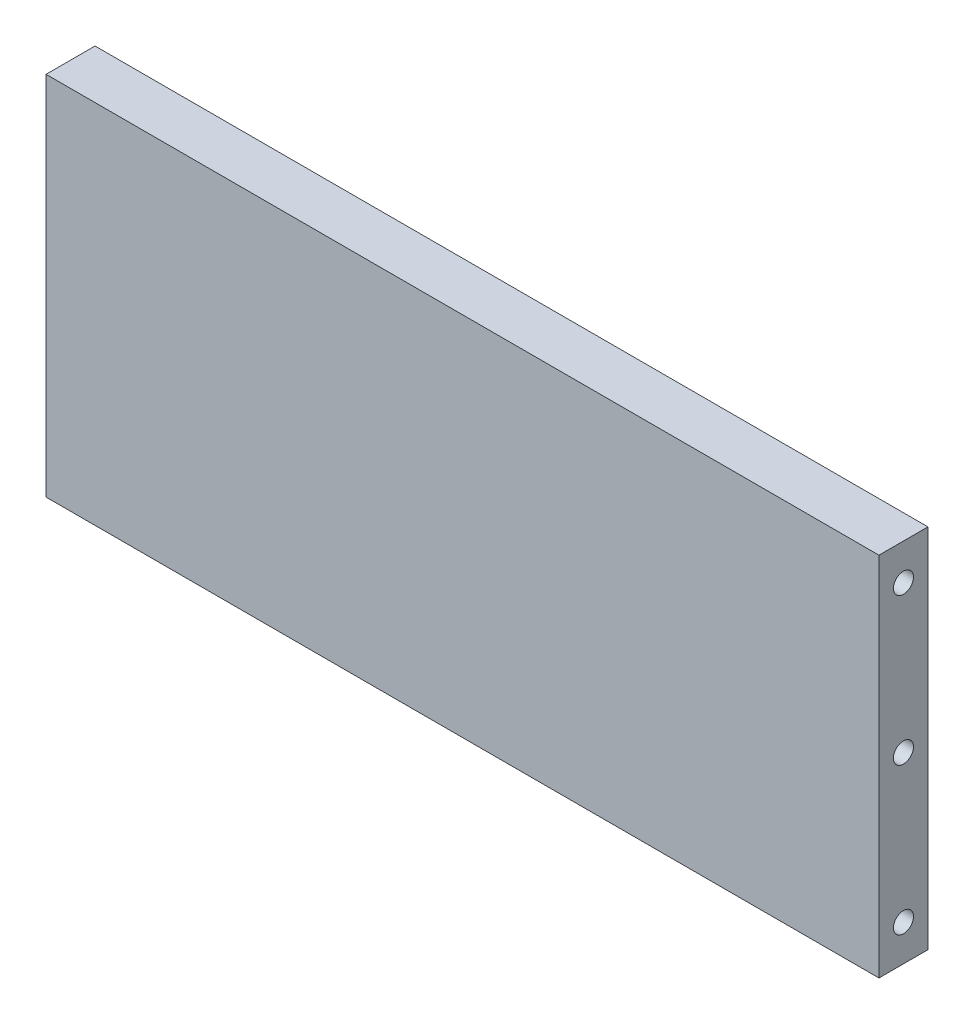
from build123d import *

# Parameters (mm, degrees)
SKETCH1_W           = 10
SKETCH1_H           = 74.74
SKETCH1_R           = 2.05
BOSS_EXTRUDE1_DEPTH = 85
SKETCH1_2_R         = 2.05
BOSS_EXTRUDE2_DEPTH = 75
SKETCH2_R           = 1.75
CUT_EXTRUDE1_DEPTH  = 8
SKETCH3_R           = 1.75
CUT_EXTRUDE2_DEPTH  = 8


with BuildPart() as part:
    # Sketch1 → Boss-Extrude1 (new, symmetric)
    with BuildSketch(Plane(origin=(0, 0, 0), x_dir=(0, 0, -1), z_dir=(1, 0, 0))):
        Rectangle(SKETCH1_W, SKETCH1_H)
        with Locations((0, 30)):
            Circle(SKETCH1_R, mode=Mode.SUBTRACT)
        with Locations((0, -30)):
            Circle(SKETCH1_R, mode=Mode.SUBTRACT)
        Circle(SKETCH1_R, mode=Mode.SUBTRACT)
    extrude(amount=BOSS_EXTRUDE1_DEPTH, both=True)

    # Sketch1<2> → Boss-Extrude2 (add, symmetric)
    with BuildSketch(Plane(origin=(0, 0, 0), x_dir=(0, 0, -1), z_dir=(1, 0, 0))):
        with Locations((0, 30)):
            Circle(SKETCH1_2_R)
        with Locations((0, -30)):
            Circle(SKETCH1_2_R)
        Circle(SKETCH1_2_R)
    extrude(amount=BOSS_EXTRUDE2_DEPTH, both=True)

    # Sketch2 → Cut-Extrude1 (cut)
    with BuildSketch(Plane(origin=(0, 0, -5), x_dir=(-1, 0, 0), z_dir=(0, 0, -1))):
        with Locations((-37, 22)):
            Circle(SKETCH2_R)
        with Locations((37, 22)):
            Circle(SKETCH2_R)
        with Locations((37, -22)):
            Circle(SKETCH2_R)
        with Locations((-37, -22)):
            Circle(SKETCH2_R)
    extrude(amount=-CUT_EXTRUDE1_DEPTH, mode=Mode.SUBTRACT)

    # Sketch3 → Cut-Extrude2 (cut)
    with BuildSketch(Plane(origin=(0, 0, -5), x_dir=(-1, 0, 0), z_dir=(0, 0, -1))):
        with Locations((-29, 24.5)):
            Circle(SKETCH3_R)
        with Locations((29, 24.5)):
            Circle(SKETCH3_R)
        with Locations((29, -24.5)):
            Circle(SKETCH3_R)
        with Locations((-29, -24.5)):
            Circle(SKETCH3_R)
    extrude(amount=-CUT_EXTRUDE2_DEPTH, mode=Mode.SUBTRACT)


solid = part.part
